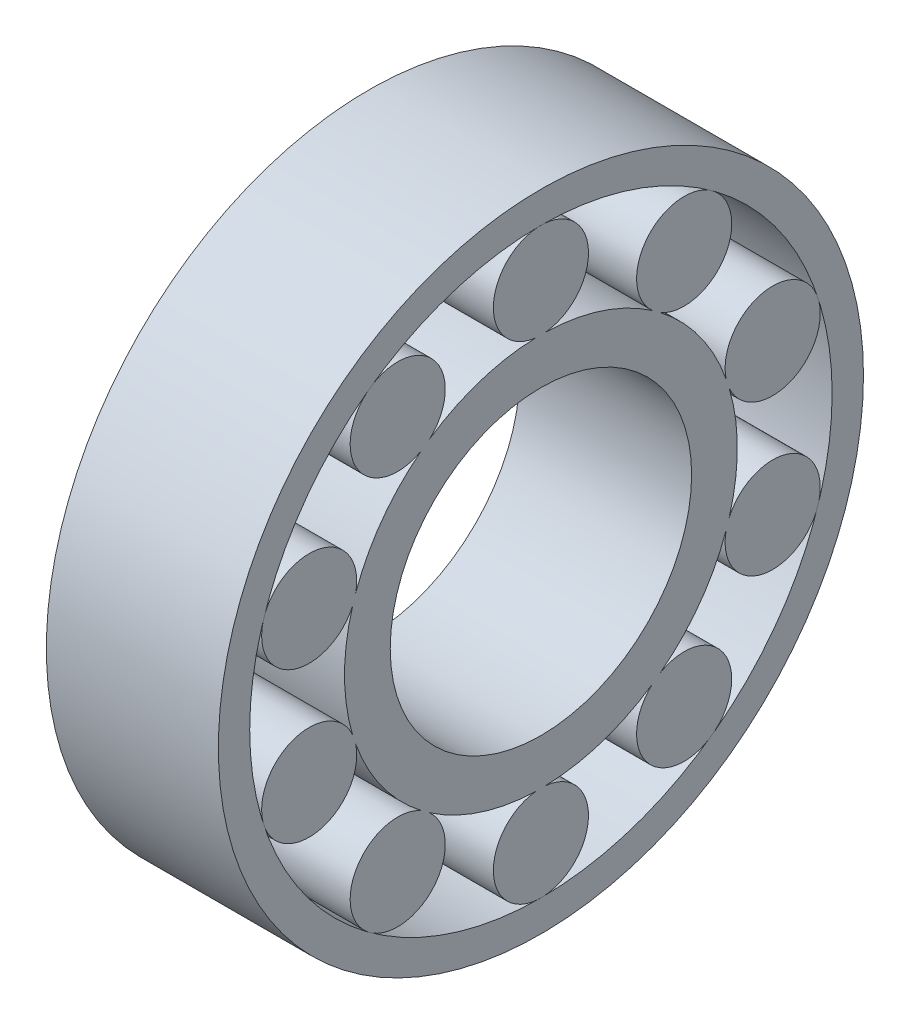
from build123d import *

# Parameters (mm, degrees)
CROQUIS1_R              = 23.8125
CROQUIS1_R_2            = 11.125
SALIENTE_EXTRUIR1_DEPTH = 12.7
CROQUIS2_R              = 21.5
CROQUIS2_R_2            = 14.5
CORTAR_EXTRUIR1_DEPTH   = 12.7
CROQUIS3_R              = 3.511424915
SALIENTE_EXTRUIR2_DEPTH = 12.7


with BuildPart() as part:
    # Croquis1 → Saliente-Extruir1 (new body)
    with BuildSketch(Plane(origin=(0, 0, 0), x_dir=(0, 0, -1), z_dir=(1, 0, 0))):
        Circle(CROQUIS1_R)
        Circle(CROQUIS1_R_2, mode=Mode.SUBTRACT)
    extrude(amount=SALIENTE_EXTRUIR1_DEPTH)

    # Croquis2 → Cortar-Extruir1 (cut)
    with BuildSketch(Plane(origin=(12.7, 0, 0), x_dir=(0, 0, -1), z_dir=(1, 0, 0))):
        Circle(CROQUIS2_R)
        Circle(CROQUIS2_R_2, mode=Mode.SUBTRACT)
    extrude(amount=-CORTAR_EXTRUIR1_DEPTH, mode=Mode.SUBTRACT)


with BuildPart() as cortar_extruir1_piece_1:
    # of the separate pieces the step leaves, piece 1, a body of its own (cortar_extruir1_pieces)
    add(part.part.solids().sort_by_distance((0, 0, -23.8125))[0])


with BuildPart() as cortar_extruir1_piece_2:
    # of the separate pieces the step leaves, piece 2, a body of its own (cortar_extruir1_pieces)
    add(part.part.solids().sort_by_distance((0, 0, -14.5))[0])

    # Croquis3 → Saliente-Extruir2 (add)
    with BuildSketch(Plane(origin=(12.7, 0, 0), x_dir=(0, 0, -1), z_dir=(1, 0, 0))):
        with Locations((0, 17.988575085)):
            Circle(CROQUIS3_R)
        with Locations((10.573419145, 14.553062949)):
            Circle(CROQUIS3_R)
        with Locations((17.108151554, 5.558775406)):
            Circle(CROQUIS3_R)
        with Locations((17.108151554, -5.558775406)):
            Circle(CROQUIS3_R)
        with Locations((10.573419145, -14.553062949)):
            Circle(CROQUIS3_R)
        with Locations((0, -17.988575085)):
            Circle(CROQUIS3_R)
        with Locations((-10.573419145, -14.553062949)):
            Circle(CROQUIS3_R)
        with Locations((-17.108151554, -5.558775406)):
            Circle(CROQUIS3_R)
        with Locations((-17.108151554, 5.558775406)):
            Circle(CROQUIS3_R)
        with Locations((-10.573419145, 14.553062949)):
            Circle(CROQUIS3_R)
    extrude(amount=-SALIENTE_EXTRUIR2_DEPTH)


solid = Compound([cortar_extruir1_piece_1.part, cortar_extruir1_piece_2.part])
